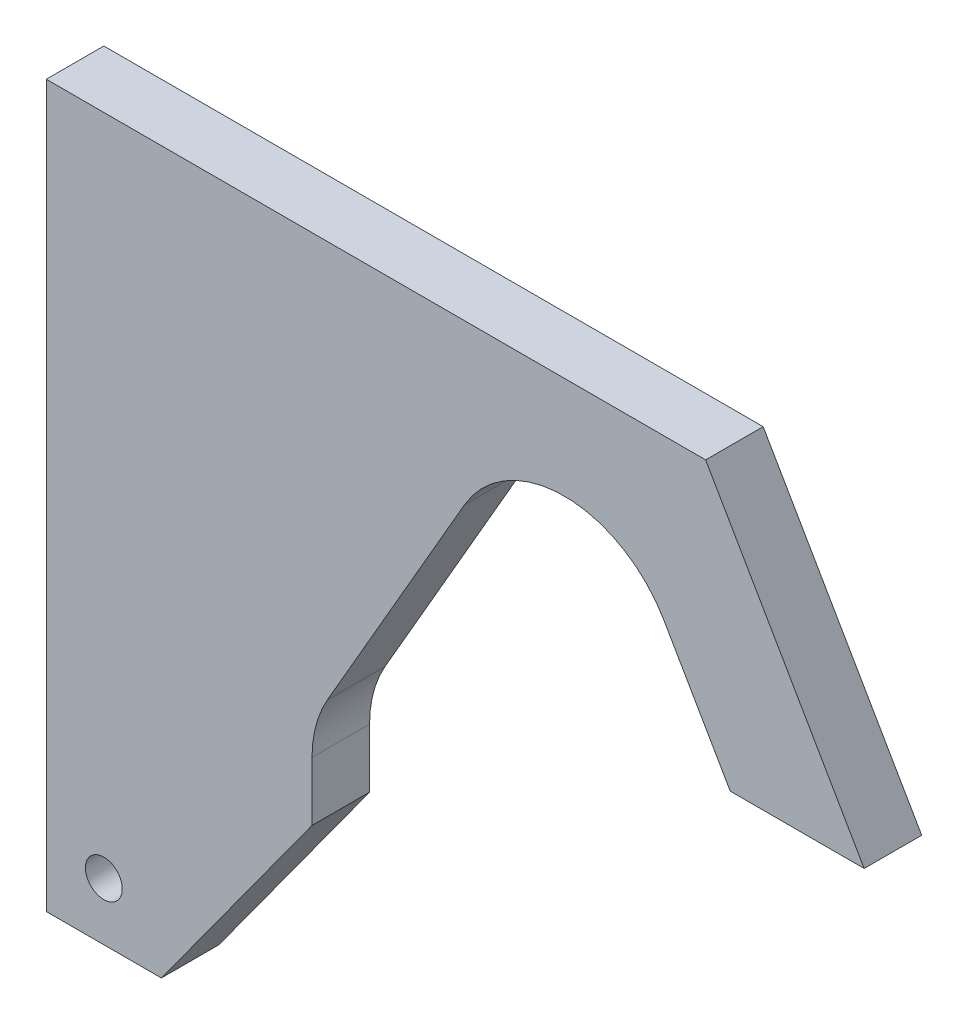
from build123d import *

# Parameters (mm, degrees)
BOSS_EXTRUDE1_DEPTH = 6.35
SKETCH3_R           = 2.032
CUT_EXTRUDE1_DEPTH  = 80.985269666


with BuildPart() as part:
    # Sketch1 → Boss-Extrude1 (new body)
    with BuildSketch(Plane.XY):
        with BuildLine():
            Line((-10.998522628, 6.35), (-26.121491239, -19.843749996))
            ThreePointArc((-26.121491239, -19.843749996), (-27.390226605, -22.906748123), (-27.822968611, -26.193749996))
            Line((-27.822968611, -26.193749996), (-27.822968611, -32.702820897))
            Line((-27.822968611, -32.702820897), (-44.45, -55.598546415))
            Line((-44.45, -55.598546415), (-57.15, -55.598546415))
            Line((-57.15, -55.598546415), (-57.15, 23.954310777))
            Line((-57.15, 23.954310777), (15.615566787, 23.954310777))
            Line((15.615566787, 23.954310777), (33.111768772, -6.35))
            Line((33.111768772, -6.35), (18.330871047, -6.35))
            Line((18.330871047, -6.35), (10.998522628, 6.35))
            ThreePointArc((10.998522628, 6.35), (0, 12.7), (-10.998522628, 6.35))
        make_face()
    extrude(amount=BOSS_EXTRUDE1_DEPTH)

    # Sketch3 → Cut-Extrude1 (cut, through all)
    with BuildSketch(Plane.XY.offset(6.35)):
        with Locations((-50.8, -49.248546415)):
            Circle(SKETCH3_R)
    extrude(amount=-CUT_EXTRUDE1_DEPTH, mode=Mode.SUBTRACT)


solid = part.part
